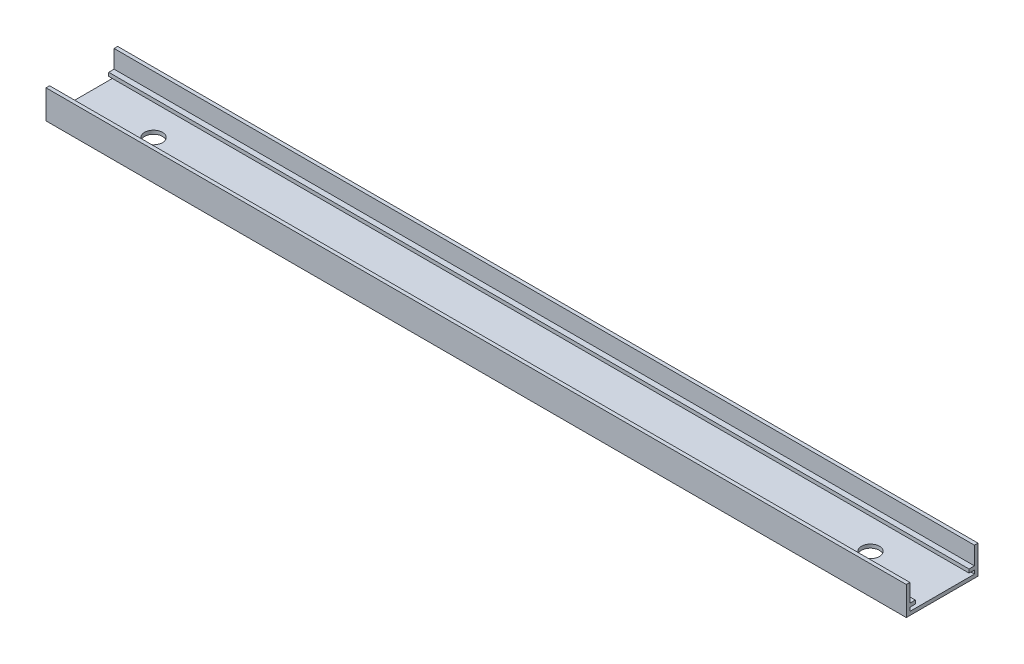
from build123d import *

# Parameters (mm, degrees)
BOSS_EXTRUDE1_DEPTH = 304.8
SKETCH2_R           = 3.175
CUT_EXTRUDE2_DEPTH  = 306.985673031


with BuildPart() as part:
    # Sketch1 → Boss-Extrude1 (new body)
    with BuildSketch(Plane(origin=(0, 0, 0), x_dir=(0, 0, -1), z_dir=(1, 0, 0))):
        Polygon((0, 0), (25.4, 0), (25.4, 10.16), (24.13, 10.16), (24.13, 3.81), (22.224108836, 3.81), (22.224108836, 2.54), (24.13, 2.54), (24.13, 1.27), (1.27, 1.27), (1.27, 2.54), (3.175891164, 2.54), (3.175891164, 3.81), (1.27, 3.81), (1.27, 10.16), (0, 10.16), align=None)
    extrude(amount=-BOSS_EXTRUDE1_DEPTH)

    # Sketch2 → Cut-Extrude2 (cut, through all)
    with BuildSketch(Plane(origin=(0, 1.27, 0), x_dir=(1, 0, 0), z_dir=(0, 1, 0))):
        with Locations(Location((-279.4, 12.7, 0), (0, 0, 270))):
            Circle(SKETCH2_R)
        with Locations(Location((-25.4, 12.7, 0), (0, 0, 90))):
            Circle(SKETCH2_R)
    extrude(amount=-CUT_EXTRUDE2_DEPTH, mode=Mode.SUBTRACT)


solid = part.part
